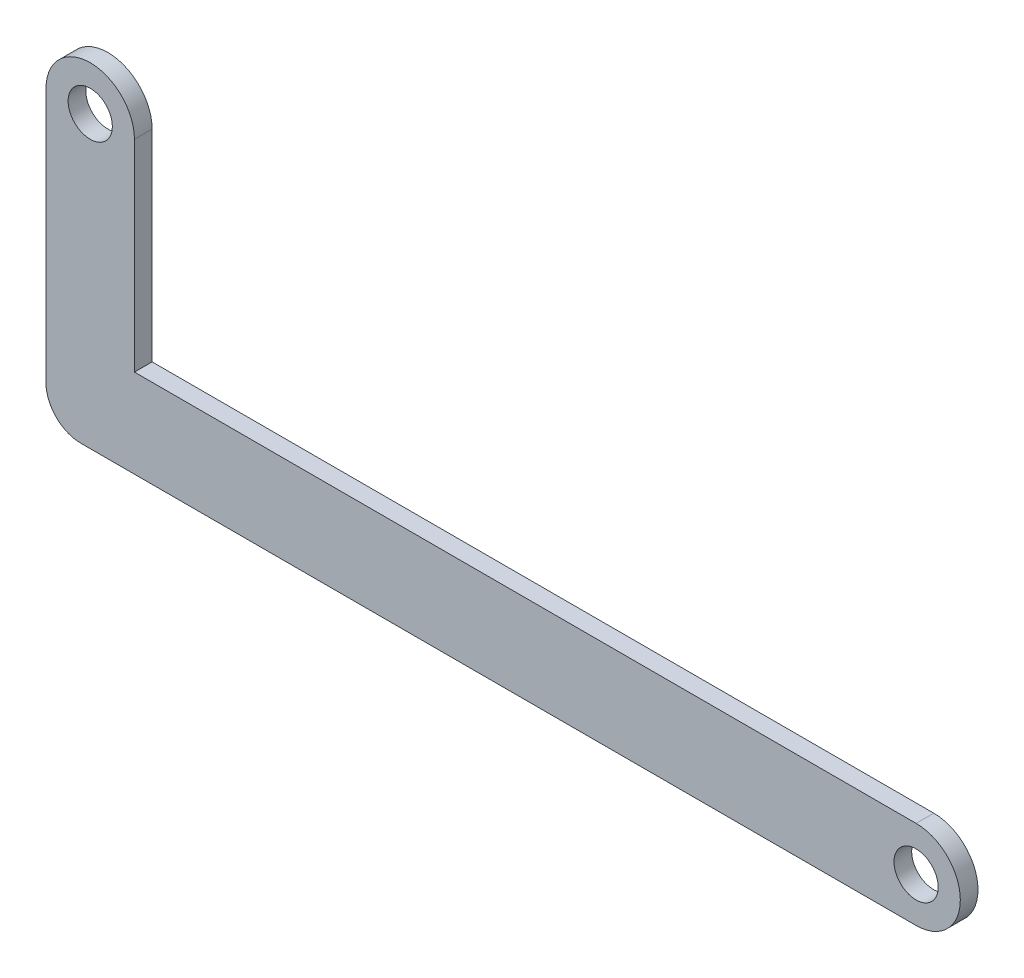
from build123d import *

# Parameters (mm, degrees)
SKETCH2_R           = 6.35
BOSS_EXTRUDE1_DEPTH = 5.08


with BuildPart() as part:
    # Sketch2 → Boss-Extrude1 (new body)
    with BuildSketch(Plane(origin=(0, 0, 0), x_dir=(1, 0, 0), z_dir=(0, 0, -1))):
        with BuildLine():
            Line((-249.9, -70.6), (-249.9, 2.7))
            ThreePointArc((-249.9, 2.7), (-246.971067812, 9.771067812), (-239.9, 12.7))
            Line((-239.9, 12.7), (0, 12.7))
            ThreePointArc((0, 12.7), (12.7, 0), (0, -12.7))
            Line((0, -12.7), (-224.5, -12.7))
            Line((-224.5, -12.7), (-224.5, -70.6))
            ThreePointArc((-224.5, -70.6), (-237.2, -83.3), (-249.9, -70.6))
        make_face()
        with Locations(Location((0, 0, 0), (0, 0, 180))):
            Circle(SKETCH2_R, mode=Mode.SUBTRACT)
        with Locations((-237.2, -70.6)):
            Circle(SKETCH2_R, mode=Mode.SUBTRACT)
    extrude(amount=BOSS_EXTRUDE1_DEPTH)


solid = part.part
